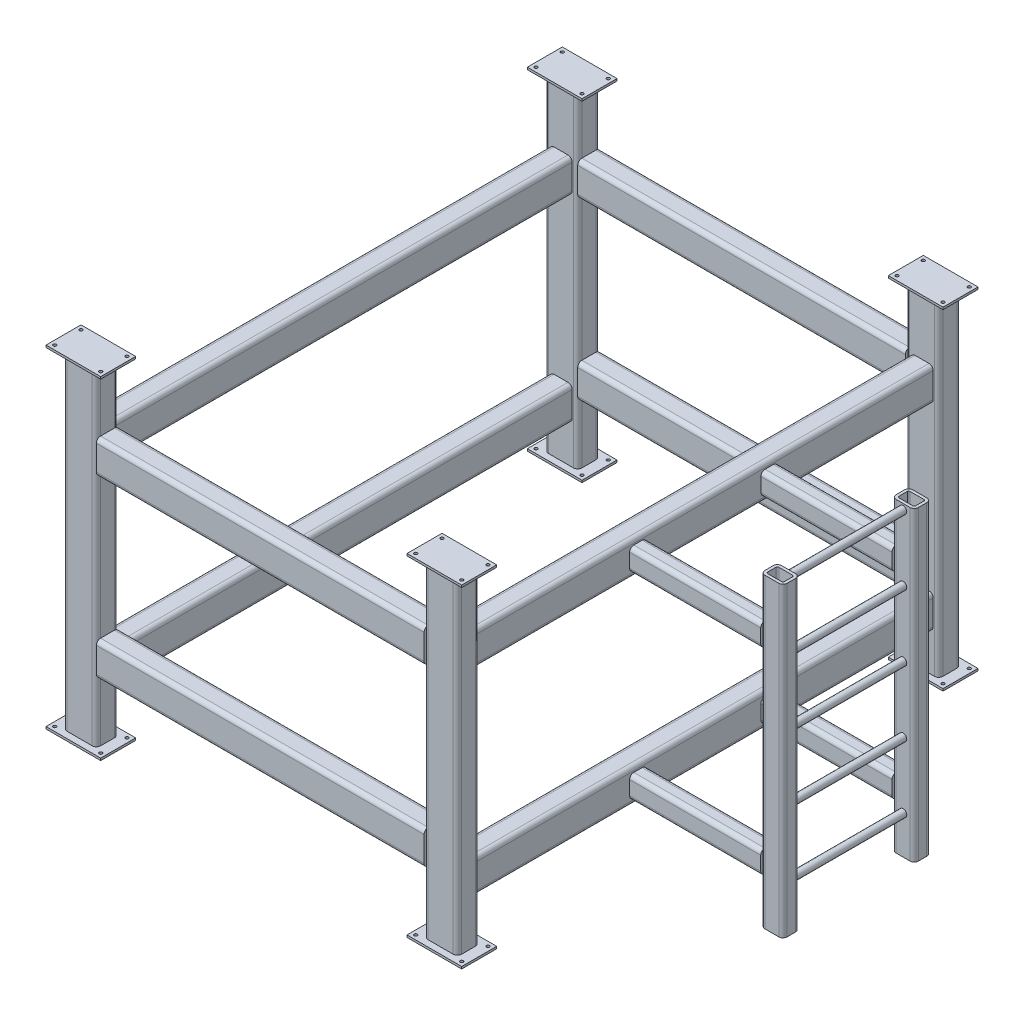
from build123d import *

# Parameters (mm, degrees)
RECTANGULAR_TUBE_6_X_4_X_0_5_1_DEPTH    = 1500
RECTANGULAR_TUBE_6_X_4_X_0_5_1_2_DEPTH  = 1500
RECTANGULAR_TUBE_6_X_4_X_0_5_1_3_DEPTH  = 1500
RECTANGULAR_TUBE_6_X_4_X_0_5_1_4_DEPTH  = 1500
RECTANGULAR_TUBE_6_X_4_X_0_5_2_DEPTH    = 2200
RECTANGULAR_TUBE_6_X_4_X_0_5_2_2_DEPTH  = 2200
RECTANGULAR_TUBE_6_X_4_X_0_5_2_3_DEPTH  = 2200
RECTANGULAR_TUBE_6_X_4_X_0_5_2_4_DEPTH  = 2200
RECTANGULAR_TUBE_6_X_4_X_0_5_5_DEPTH    = 1650
RECTANGULAR_TUBE_6_X_4_X_0_5_5_2_DEPTH  = 1650
RECTANGULAR_TUBE_6_X_4_X_0_5_5_3_DEPTH  = 1650
RECTANGULAR_TUBE_6_X_4_X_0_5_5_4_DEPTH  = 1650
SKETCH14_W                              = 250
SKETCH14_H                              = 160
SKETCH14_R                              = 7
BOSS_EXTRUDE1_DEPTH                     = 10
BOSS_EXTRUDE1_2_DEPTH                   = 10
BOSS_EXTRUDE1_3_DEPTH                   = 10
BOSS_EXTRUDE1_4_DEPTH                   = 10
BOSS_EXTRUDE2_START                     = -1500
SKETCH14_2_W                            = 250
SKETCH14_2_H                            = 160
SKETCH14_2_R                            = 7
BOSS_EXTRUDE2_DEPTH                     = 10
BOSS_EXTRUDE2_2_DEPTH                   = 10
BOSS_EXTRUDE2_3_DEPTH                   = 10
BOSS_EXTRUDE2_4_DEPTH                   = 10
RECTANGULAR_TUBE_4_X_3_X_0_25_1_DEPTH   = 651
RECTANGULAR_TUBE_4_X_3_X_0_25_1_2_DEPTH = 651
RECTANGULAR_TUBE_4_X_3_X_0_25_1_3_DEPTH = 651
RECTANGULAR_TUBE_4_X_3_X_0_25_1_4_DEPTH = 651
RECTANGULAR_TUBE_4_X_3_X_0_25_1_5_DEPTH = 1400
RECTANGULAR_TUBE_4_X_3_X_0_25_1_6_DEPTH = 1400
SKETCH111_R                             = 16.7005
SKETCH111_R_2                           = 13.3223
PIPE_1_0_SCH_40_1_DEPTH                 = 523.8
LPATTERN1_COUNT                         = 5
LPATTERN1_PITCH                         = 300


with BuildPart() as part:
    # Sketch1 → Rectangular tube 6 X 4 X 0.5(1) (new body)
    with BuildSketch(Plane(origin=(-825, 0, 1100), x_dir=(0, 0, -1), z_dir=(0, 1, 0))):
        with BuildLine():
            Line((-31.75, -76.2), (31.75, -76.2))
            ThreePointArc((31.75, -76.2), (45.220384182, -70.620384182), (50.8, -57.15))
            Line((50.8, -57.15), (50.8, 57.15))
            ThreePointArc((50.8, 57.15), (45.220384182, 70.620384182), (31.75, 76.2))
            Line((31.75, 76.2), (-31.75, 76.2))
            ThreePointArc((-31.75, 76.2), (-45.220384182, 70.620384182), (-50.8, 57.15))
            Line((-50.8, 57.15), (-50.8, -57.15))
            ThreePointArc((-50.8, -57.15), (-45.220384182, -70.620384182), (-31.75, -76.2))
        make_face()
        with BuildLine():
            Line((-31.75, -63.5), (31.75, -63.5))
            ThreePointArc((31.75, -63.5), (36.240128061, -61.640128061), (38.1, -57.15))
            Line((38.1, -57.15), (38.1, 57.15))
            ThreePointArc((38.1, 57.15), (36.240128061, 61.640128061), (31.75, 63.5))
            Line((31.75, 63.5), (-31.75, 63.5))
            ThreePointArc((-31.75, 63.5), (-36.240128061, 61.640128061), (-38.1, 57.15))
            Line((-38.1, 57.15), (-38.1, -57.15))
            ThreePointArc((-38.1, -57.15), (-36.240128061, -61.640128061), (-31.75, -63.5))
        make_face(mode=Mode.SUBTRACT)
    extrude(amount=RECTANGULAR_TUBE_6_X_4_X_0_5_1_DEPTH)


with BuildPart() as body_2:
    # Sketch1 on segment 2 (carried to segment 2) → Rectangular tube 6 X 4 X 0.5_1 2 (new body)
    with BuildSketch(Plane(origin=(-825, 0, -1100), x_dir=(0, 0, -1), z_dir=(0, 1, 0))):
        with BuildLine():
            Line((-31.75, -76.2), (31.75, -76.2))
            ThreePointArc((31.75, -76.2), (45.220384182, -70.620384182), (50.8, -57.15))
            Line((50.8, -57.15), (50.8, 57.15))
            ThreePointArc((50.8, 57.15), (45.220384182, 70.620384182), (31.75, 76.2))
            Line((31.75, 76.2), (-31.75, 76.2))
            ThreePointArc((-31.75, 76.2), (-45.220384182, 70.620384182), (-50.8, 57.15))
            Line((-50.8, 57.15), (-50.8, -57.15))
            ThreePointArc((-50.8, -57.15), (-45.220384182, -70.620384182), (-31.75, -76.2))
        make_face()
        with BuildLine():
            Line((-31.75, -63.5), (31.75, -63.5))
            ThreePointArc((31.75, -63.5), (36.240128061, -61.640128061), (38.1, -57.15))
            Line((38.1, -57.15), (38.1, 57.15))
            ThreePointArc((38.1, 57.15), (36.240128061, 61.640128061), (31.75, 63.5))
            Line((31.75, 63.5), (-31.75, 63.5))
            ThreePointArc((-31.75, 63.5), (-36.240128061, 61.640128061), (-38.1, 57.15))
            Line((-38.1, 57.15), (-38.1, -57.15))
            ThreePointArc((-38.1, -57.15), (-36.240128061, -61.640128061), (-31.75, -63.5))
        make_face(mode=Mode.SUBTRACT)
    extrude(amount=RECTANGULAR_TUBE_6_X_4_X_0_5_1_2_DEPTH)


with BuildPart() as body_3:
    # Sketch1 on segment 3 (carried to segment 3) → Rectangular tube 6 X 4 X 0.5_1 3 (new body)
    with BuildSketch(Plane(origin=(825, 0, 1100), x_dir=(0, 0, -1), z_dir=(0, 1, 0))):
        with BuildLine():
            Line((-31.75, -76.2), (31.75, -76.2))
            ThreePointArc((31.75, -76.2), (45.220384182, -70.620384182), (50.8, -57.15))
            Line((50.8, -57.15), (50.8, 57.15))
            ThreePointArc((50.8, 57.15), (45.220384182, 70.620384182), (31.75, 76.2))
            Line((31.75, 76.2), (-31.75, 76.2))
            ThreePointArc((-31.75, 76.2), (-45.220384182, 70.620384182), (-50.8, 57.15))
            Line((-50.8, 57.15), (-50.8, -57.15))
            ThreePointArc((-50.8, -57.15), (-45.220384182, -70.620384182), (-31.75, -76.2))
        make_face()
        with BuildLine():
            Line((-31.75, -63.5), (31.75, -63.5))
            ThreePointArc((31.75, -63.5), (36.240128061, -61.640128061), (38.1, -57.15))
            Line((38.1, -57.15), (38.1, 57.15))
            ThreePointArc((38.1, 57.15), (36.240128061, 61.640128061), (31.75, 63.5))
            Line((31.75, 63.5), (-31.75, 63.5))
            ThreePointArc((-31.75, 63.5), (-36.240128061, 61.640128061), (-38.1, 57.15))
            Line((-38.1, 57.15), (-38.1, -57.15))
            ThreePointArc((-38.1, -57.15), (-36.240128061, -61.640128061), (-31.75, -63.5))
        make_face(mode=Mode.SUBTRACT)
    extrude(amount=RECTANGULAR_TUBE_6_X_4_X_0_5_1_3_DEPTH)


with BuildPart() as body_4:
    # Sketch1 on segment 4 (carried to segment 4) → Rectangular tube 6 X 4 X 0.5_1 4 (new body)
    with BuildSketch(Plane(origin=(825, 0, -1100), x_dir=(0, 0, -1), z_dir=(0, 1, 0))):
        with BuildLine():
            Line((-31.75, -76.2), (31.75, -76.2))
            ThreePointArc((31.75, -76.2), (45.220384182, -70.620384182), (50.8, -57.15))
            Line((50.8, -57.15), (50.8, 57.15))
            ThreePointArc((50.8, 57.15), (45.220384182, 70.620384182), (31.75, 76.2))
            Line((31.75, 76.2), (-31.75, 76.2))
            ThreePointArc((-31.75, 76.2), (-45.220384182, 70.620384182), (-50.8, 57.15))
            Line((-50.8, 57.15), (-50.8, -57.15))
            ThreePointArc((-50.8, -57.15), (-45.220384182, -70.620384182), (-31.75, -76.2))
        make_face()
        with BuildLine():
            Line((-31.75, -63.5), (31.75, -63.5))
            ThreePointArc((31.75, -63.5), (36.240128061, -61.640128061), (38.1, -57.15))
            Line((38.1, -57.15), (38.1, 57.15))
            ThreePointArc((38.1, 57.15), (36.240128061, 61.640128061), (31.75, 63.5))
            Line((31.75, 63.5), (-31.75, 63.5))
            ThreePointArc((-31.75, 63.5), (-36.240128061, 61.640128061), (-38.1, 57.15))
            Line((-38.1, 57.15), (-38.1, -57.15))
            ThreePointArc((-38.1, -57.15), (-36.240128061, -61.640128061), (-31.75, -63.5))
        make_face(mode=Mode.SUBTRACT)
    extrude(amount=RECTANGULAR_TUBE_6_X_4_X_0_5_1_4_DEPTH)


with BuildPart() as body_5:
    # Sketch11 → Rectangular tube 6 X 4 X 0.5(2) (new body)
    with BuildSketch(Plane(origin=(-825, 1150, 1100), x_dir=(1, 0, 0), z_dir=(0, 0, -1))):
        with BuildLine():
            Line((-31.75, -76.2), (31.75, -76.2))
            ThreePointArc((31.75, -76.2), (45.220384182, -70.620384182), (50.8, -57.15))
            Line((50.8, -57.15), (50.8, 57.15))
            ThreePointArc((50.8, 57.15), (45.220384182, 70.620384182), (31.75, 76.2))
            Line((31.75, 76.2), (-31.75, 76.2))
            ThreePointArc((-31.75, 76.2), (-45.220384182, 70.620384182), (-50.8, 57.15))
            Line((-50.8, 57.15), (-50.8, -57.15))
            ThreePointArc((-50.8, -57.15), (-45.220384182, -70.620384182), (-31.75, -76.2))
        make_face()
        with BuildLine():
            Line((-31.75, -63.5), (31.75, -63.5))
            ThreePointArc((31.75, -63.5), (36.240128061, -61.640128061), (38.1, -57.15))
            Line((38.1, -57.15), (38.1, 57.15))
            ThreePointArc((38.1, 57.15), (36.240128061, 61.640128061), (31.75, 63.5))
            Line((31.75, 63.5), (-31.75, 63.5))
            ThreePointArc((-31.75, 63.5), (-36.240128061, 61.640128061), (-38.1, 57.15))
            Line((-38.1, 57.15), (-38.1, -57.15))
            ThreePointArc((-38.1, -57.15), (-36.240128061, -61.640128061), (-31.75, -63.5))
        make_face(mode=Mode.SUBTRACT)
    extrude(amount=RECTANGULAR_TUBE_6_X_4_X_0_5_2_DEPTH)

    # Trim_Extend1 3
    split(bisect_by=Plane(origin=(-825, 750, 1049.2), x_dir=(0, 1, 0), z_dir=(0, 0, -1)), keep=Keep.TOP)

    # Trim_Extend1 5
    split(bisect_by=Plane(origin=(-825, 750, -1049.2), x_dir=(0, -1, 0), z_dir=(0, 0, 1)), keep=Keep.TOP)


with BuildPart() as body_6:
    # Sketch11 on segment 2 (carried to segment 2) → Rectangular tube 6 X 4 X 0.5_2 2 (new body)
    with BuildSketch(Plane(origin=(-825, 250, 1100), x_dir=(1, 0, 0), z_dir=(0, 0, -1))):
        with BuildLine():
            Line((-31.75, -76.2), (31.75, -76.2))
            ThreePointArc((31.75, -76.2), (45.220384182, -70.620384182), (50.8, -57.15))
            Line((50.8, -57.15), (50.8, 57.15))
            ThreePointArc((50.8, 57.15), (45.220384182, 70.620384182), (31.75, 76.2))
            Line((31.75, 76.2), (-31.75, 76.2))
            ThreePointArc((-31.75, 76.2), (-45.220384182, 70.620384182), (-50.8, 57.15))
            Line((-50.8, 57.15), (-50.8, -57.15))
            ThreePointArc((-50.8, -57.15), (-45.220384182, -70.620384182), (-31.75, -76.2))
        make_face()
        with BuildLine():
            Line((-31.75, -63.5), (31.75, -63.5))
            ThreePointArc((31.75, -63.5), (36.240128061, -61.640128061), (38.1, -57.15))
            Line((38.1, -57.15), (38.1, 57.15))
            ThreePointArc((38.1, 57.15), (36.240128061, 61.640128061), (31.75, 63.5))
            Line((31.75, 63.5), (-31.75, 63.5))
            ThreePointArc((-31.75, 63.5), (-36.240128061, 61.640128061), (-38.1, 57.15))
            Line((-38.1, 57.15), (-38.1, -57.15))
            ThreePointArc((-38.1, -57.15), (-36.240128061, -61.640128061), (-31.75, -63.5))
        make_face(mode=Mode.SUBTRACT)
    extrude(amount=RECTANGULAR_TUBE_6_X_4_X_0_5_2_2_DEPTH)

    # Trim_Extend1 3
    split(bisect_by=Plane(origin=(-825, 750, 1049.2), x_dir=(0, 1, 0), z_dir=(0, 0, -1)), keep=Keep.TOP)

    # Trim_Extend1 5
    split(bisect_by=Plane(origin=(-825, 750, -1049.2), x_dir=(0, -1, 0), z_dir=(0, 0, 1)), keep=Keep.TOP)


with BuildPart() as body_7:
    # Sketch11 on segment 3 (carried to segment 3) → Rectangular tube 6 X 4 X 0.5_2 3 (new body)
    with BuildSketch(Plane(origin=(825, 1150, 1100), x_dir=(1, 0, 0), z_dir=(0, 0, -1))):
        with BuildLine():
            Line((-31.75, -76.2), (31.75, -76.2))
            ThreePointArc((31.75, -76.2), (45.220384182, -70.620384182), (50.8, -57.15))
            Line((50.8, -57.15), (50.8, 57.15))
            ThreePointArc((50.8, 57.15), (45.220384182, 70.620384182), (31.75, 76.2))
            Line((31.75, 76.2), (-31.75, 76.2))
            ThreePointArc((-31.75, 76.2), (-45.220384182, 70.620384182), (-50.8, 57.15))
            Line((-50.8, 57.15), (-50.8, -57.15))
            ThreePointArc((-50.8, -57.15), (-45.220384182, -70.620384182), (-31.75, -76.2))
        make_face()
        with BuildLine():
            Line((-31.75, -63.5), (31.75, -63.5))
            ThreePointArc((31.75, -63.5), (36.240128061, -61.640128061), (38.1, -57.15))
            Line((38.1, -57.15), (38.1, 57.15))
            ThreePointArc((38.1, 57.15), (36.240128061, 61.640128061), (31.75, 63.5))
            Line((31.75, 63.5), (-31.75, 63.5))
            ThreePointArc((-31.75, 63.5), (-36.240128061, 61.640128061), (-38.1, 57.15))
            Line((-38.1, 57.15), (-38.1, -57.15))
            ThreePointArc((-38.1, -57.15), (-36.240128061, -61.640128061), (-31.75, -63.5))
        make_face(mode=Mode.SUBTRACT)
    extrude(amount=RECTANGULAR_TUBE_6_X_4_X_0_5_2_3_DEPTH)

    # Trim_Extend1 3
    split(bisect_by=Plane(origin=(-825, 750, 1049.2), x_dir=(0, 1, 0), z_dir=(0, 0, -1)), keep=Keep.TOP)

    # Trim_Extend1 5
    split(bisect_by=Plane(origin=(-825, 750, -1049.2), x_dir=(0, -1, 0), z_dir=(0, 0, 1)), keep=Keep.TOP)


with BuildPart() as body_8:
    # Sketch11 on segment 4 (carried to segment 4) → Rectangular tube 6 X 4 X 0.5_2 4 (new body)
    with BuildSketch(Plane(origin=(825, 250, 1100), x_dir=(1, 0, 0), z_dir=(0, 0, -1))):
        with BuildLine():
            Line((-31.75, -76.2), (31.75, -76.2))
            ThreePointArc((31.75, -76.2), (45.220384182, -70.620384182), (50.8, -57.15))
            Line((50.8, -57.15), (50.8, 57.15))
            ThreePointArc((50.8, 57.15), (45.220384182, 70.620384182), (31.75, 76.2))
            Line((31.75, 76.2), (-31.75, 76.2))
            ThreePointArc((-31.75, 76.2), (-45.220384182, 70.620384182), (-50.8, 57.15))
            Line((-50.8, 57.15), (-50.8, -57.15))
            ThreePointArc((-50.8, -57.15), (-45.220384182, -70.620384182), (-31.75, -76.2))
        make_face()
        with BuildLine():
            Line((-31.75, -63.5), (31.75, -63.5))
            ThreePointArc((31.75, -63.5), (36.240128061, -61.640128061), (38.1, -57.15))
            Line((38.1, -57.15), (38.1, 57.15))
            ThreePointArc((38.1, 57.15), (36.240128061, 61.640128061), (31.75, 63.5))
            Line((31.75, 63.5), (-31.75, 63.5))
            ThreePointArc((-31.75, 63.5), (-36.240128061, 61.640128061), (-38.1, 57.15))
            Line((-38.1, 57.15), (-38.1, -57.15))
            ThreePointArc((-38.1, -57.15), (-36.240128061, -61.640128061), (-31.75, -63.5))
        make_face(mode=Mode.SUBTRACT)
    extrude(amount=RECTANGULAR_TUBE_6_X_4_X_0_5_2_4_DEPTH)

    # Trim_Extend1 3
    split(bisect_by=Plane(origin=(-825, 750, 1049.2), x_dir=(0, 1, 0), z_dir=(0, 0, -1)), keep=Keep.TOP)

    # Trim_Extend1 5
    split(bisect_by=Plane(origin=(-825, 750, -1049.2), x_dir=(0, -1, 0), z_dir=(0, 0, 1)), keep=Keep.TOP)


with BuildPart() as body_9:
    # Sketch13 → Rectangular tube 6 X 4 X 0.5(5) (new body)
    with BuildSketch(Plane(origin=(-825, 1150, 1100), x_dir=(0, 0, -1), z_dir=(1, 0, 0))):
        with BuildLine():
            Line((-31.75, -76.2), (31.75, -76.2))
            ThreePointArc((31.75, -76.2), (45.220384182, -70.620384182), (50.8, -57.15))
            Line((50.8, -57.15), (50.8, 57.15))
            ThreePointArc((50.8, 57.15), (45.220384182, 70.620384182), (31.75, 76.2))
            Line((31.75, 76.2), (-31.75, 76.2))
            ThreePointArc((-31.75, 76.2), (-45.220384182, 70.620384182), (-50.8, 57.15))
            Line((-50.8, 57.15), (-50.8, -57.15))
            ThreePointArc((-50.8, -57.15), (-45.220384182, -70.620384182), (-31.75, -76.2))
        make_face()
        with BuildLine():
            Line((-31.75, -63.5), (31.75, -63.5))
            ThreePointArc((31.75, -63.5), (36.240128061, -61.640128061), (38.1, -57.15))
            Line((38.1, -57.15), (38.1, 57.15))
            ThreePointArc((38.1, 57.15), (36.240128061, 61.640128061), (31.75, 63.5))
            Line((31.75, 63.5), (-31.75, 63.5))
            ThreePointArc((-31.75, 63.5), (-36.240128061, 61.640128061), (-38.1, 57.15))
            Line((-38.1, 57.15), (-38.1, -57.15))
            ThreePointArc((-38.1, -57.15), (-36.240128061, -61.640128061), (-31.75, -63.5))
        make_face(mode=Mode.SUBTRACT)
    extrude(amount=RECTANGULAR_TUBE_6_X_4_X_0_5_5_DEPTH)

    # Trim/Extend1
    split(bisect_by=Plane(origin=(-748.8, 750, 1100), x_dir=(0, 1, 0), z_dir=(1, 0, 0)), keep=Keep.TOP)

    # Trim_Extend1 9
    split(bisect_by=Plane(origin=(748.8, 750, -1100), x_dir=(0, -1, 0), z_dir=(-1, 0, 0)), keep=Keep.TOP)


with BuildPart() as body_10:
    # Sketch13 on segment 2 (carried to segment 2) → Rectangular tube 6 X 4 X 0.5_5 2 (new body)
    with BuildSketch(Plane(origin=(-825, 350, 1100), x_dir=(0, 0, -1), z_dir=(1, 0, 0))):
        with BuildLine():
            Line((-31.75, -76.2), (31.75, -76.2))
            ThreePointArc((31.75, -76.2), (45.220384182, -70.620384182), (50.8, -57.15))
            Line((50.8, -57.15), (50.8, 57.15))
            ThreePointArc((50.8, 57.15), (45.220384182, 70.620384182), (31.75, 76.2))
            Line((31.75, 76.2), (-31.75, 76.2))
            ThreePointArc((-31.75, 76.2), (-45.220384182, 70.620384182), (-50.8, 57.15))
            Line((-50.8, 57.15), (-50.8, -57.15))
            ThreePointArc((-50.8, -57.15), (-45.220384182, -70.620384182), (-31.75, -76.2))
        make_face()
        with BuildLine():
            Line((-31.75, -63.5), (31.75, -63.5))
            ThreePointArc((31.75, -63.5), (36.240128061, -61.640128061), (38.1, -57.15))
            Line((38.1, -57.15), (38.1, 57.15))
            ThreePointArc((38.1, 57.15), (36.240128061, 61.640128061), (31.75, 63.5))
            Line((31.75, 63.5), (-31.75, 63.5))
            ThreePointArc((-31.75, 63.5), (-36.240128061, 61.640128061), (-38.1, 57.15))
            Line((-38.1, 57.15), (-38.1, -57.15))
            ThreePointArc((-38.1, -57.15), (-36.240128061, -61.640128061), (-31.75, -63.5))
        make_face(mode=Mode.SUBTRACT)
    extrude(amount=RECTANGULAR_TUBE_6_X_4_X_0_5_5_2_DEPTH)

    # Trim/Extend1
    split(bisect_by=Plane(origin=(-748.8, 750, 1100), x_dir=(0, 1, 0), z_dir=(1, 0, 0)), keep=Keep.TOP)

    # Trim_Extend1 9
    split(bisect_by=Plane(origin=(748.8, 750, -1100), x_dir=(0, -1, 0), z_dir=(-1, 0, 0)), keep=Keep.TOP)


with BuildPart() as body_11:
    # Sketch13 on segment 3 (carried to segment 3) → Rectangular tube 6 X 4 X 0.5_5 3 (new body)
    with BuildSketch(Plane(origin=(-825, 1150, -1100), x_dir=(0, 0, -1), z_dir=(1, 0, 0))):
        with BuildLine():
            Line((-31.75, -76.2), (31.75, -76.2))
            ThreePointArc((31.75, -76.2), (45.220384182, -70.620384182), (50.8, -57.15))
            Line((50.8, -57.15), (50.8, 57.15))
            ThreePointArc((50.8, 57.15), (45.220384182, 70.620384182), (31.75, 76.2))
            Line((31.75, 76.2), (-31.75, 76.2))
            ThreePointArc((-31.75, 76.2), (-45.220384182, 70.620384182), (-50.8, 57.15))
            Line((-50.8, 57.15), (-50.8, -57.15))
            ThreePointArc((-50.8, -57.15), (-45.220384182, -70.620384182), (-31.75, -76.2))
        make_face()
        with BuildLine():
            Line((-31.75, -63.5), (31.75, -63.5))
            ThreePointArc((31.75, -63.5), (36.240128061, -61.640128061), (38.1, -57.15))
            Line((38.1, -57.15), (38.1, 57.15))
            ThreePointArc((38.1, 57.15), (36.240128061, 61.640128061), (31.75, 63.5))
            Line((31.75, 63.5), (-31.75, 63.5))
            ThreePointArc((-31.75, 63.5), (-36.240128061, 61.640128061), (-38.1, 57.15))
            Line((-38.1, 57.15), (-38.1, -57.15))
            ThreePointArc((-38.1, -57.15), (-36.240128061, -61.640128061), (-31.75, -63.5))
        make_face(mode=Mode.SUBTRACT)
    extrude(amount=RECTANGULAR_TUBE_6_X_4_X_0_5_5_3_DEPTH)

    # Trim/Extend1
    split(bisect_by=Plane(origin=(-748.8, 750, 1100), x_dir=(0, 1, 0), z_dir=(1, 0, 0)), keep=Keep.TOP)

    # Trim_Extend1 9
    split(bisect_by=Plane(origin=(748.8, 750, -1100), x_dir=(0, -1, 0), z_dir=(-1, 0, 0)), keep=Keep.TOP)


with BuildPart() as body_12:
    # Sketch13 on segment 4 (carried to segment 4) → Rectangular tube 6 X 4 X 0.5_5 4 (new body)
    with BuildSketch(Plane(origin=(-825, 350, -1100), x_dir=(0, 0, -1), z_dir=(1, 0, 0))):
        with BuildLine():
            Line((-31.75, -76.2), (31.75, -76.2))
            ThreePointArc((31.75, -76.2), (45.220384182, -70.620384182), (50.8, -57.15))
            Line((50.8, -57.15), (50.8, 57.15))
            ThreePointArc((50.8, 57.15), (45.220384182, 70.620384182), (31.75, 76.2))
            Line((31.75, 76.2), (-31.75, 76.2))
            ThreePointArc((-31.75, 76.2), (-45.220384182, 70.620384182), (-50.8, 57.15))
            Line((-50.8, 57.15), (-50.8, -57.15))
            ThreePointArc((-50.8, -57.15), (-45.220384182, -70.620384182), (-31.75, -76.2))
        make_face()
        with BuildLine():
            Line((-31.75, -63.5), (31.75, -63.5))
            ThreePointArc((31.75, -63.5), (36.240128061, -61.640128061), (38.1, -57.15))
            Line((38.1, -57.15), (38.1, 57.15))
            ThreePointArc((38.1, 57.15), (36.240128061, 61.640128061), (31.75, 63.5))
            Line((31.75, 63.5), (-31.75, 63.5))
            ThreePointArc((-31.75, 63.5), (-36.240128061, 61.640128061), (-38.1, 57.15))
            Line((-38.1, 57.15), (-38.1, -57.15))
            ThreePointArc((-38.1, -57.15), (-36.240128061, -61.640128061), (-31.75, -63.5))
        make_face(mode=Mode.SUBTRACT)
    extrude(amount=RECTANGULAR_TUBE_6_X_4_X_0_5_5_4_DEPTH)

    # Trim/Extend1
    split(bisect_by=Plane(origin=(-748.8, 750, 1100), x_dir=(0, 1, 0), z_dir=(1, 0, 0)), keep=Keep.TOP)

    # Trim_Extend1 9
    split(bisect_by=Plane(origin=(748.8, 750, -1100), x_dir=(0, -1, 0), z_dir=(-1, 0, 0)), keep=Keep.TOP)


with BuildPart() as body_13:
    # Sketch14 → Boss-Extrude1 (new body)
    with BuildSketch(Plane(origin=(0, 1500, 0), x_dir=(1, 0, 0), z_dir=(0, 1, 0))):
        with Locations((-825, -1100)):
            Rectangle(SKETCH14_W, SKETCH14_H)
        with Locations(Location((-930, -1040, 0), (0, 0, 270))):
            Circle(SKETCH14_R, mode=Mode.SUBTRACT)
        with Locations(Location((-720, -1040, 0), (0, 0, 270))):
            Circle(SKETCH14_R, mode=Mode.SUBTRACT)
        with Locations(Location((-720, -1160, 0), (0, 0, 270))):
            Circle(SKETCH14_R, mode=Mode.SUBTRACT)
        with Locations(Location((-930, -1160, 0), (0, 0, 270))):
            Circle(SKETCH14_R, mode=Mode.SUBTRACT)
    extrude(amount=BOSS_EXTRUDE1_DEPTH)


with BuildPart() as body_14:
    # Sketch14 → Boss-Extrude1 2 (new body)
    with BuildSketch(Plane(origin=(0, 1500, 0), x_dir=(1, 0, 0), z_dir=(0, 1, 0))):
        with Locations((825, -1100)):
            Rectangle(SKETCH14_W, SKETCH14_H)
        with Locations(Location((930, -1160, 0), (0, 0, 90))):
            Circle(SKETCH14_R, mode=Mode.SUBTRACT)
        with Locations(Location((720, -1160, 0), (0, 0, 90))):
            Circle(SKETCH14_R, mode=Mode.SUBTRACT)
        with Locations(Location((720, -1040, 0), (0, 0, 90))):
            Circle(SKETCH14_R, mode=Mode.SUBTRACT)
        with Locations(Location((930, -1040, 0), (0, 0, 90))):
            Circle(SKETCH14_R, mode=Mode.SUBTRACT)
    extrude(amount=BOSS_EXTRUDE1_2_DEPTH)


with BuildPart() as body_15:
    # Sketch14 → Boss-Extrude1 3 (new body)
    with BuildSketch(Plane(origin=(0, 1500, 0), x_dir=(1, 0, 0), z_dir=(0, 1, 0))):
        with Locations((825, 1100)):
            Rectangle(SKETCH14_W, SKETCH14_H)
        with Locations(Location((930, 1040, 0), (0, 0, 270))):
            Circle(SKETCH14_R, mode=Mode.SUBTRACT)
        with Locations(Location((720, 1040, 0), (0, 0, 270))):
            Circle(SKETCH14_R, mode=Mode.SUBTRACT)
        with Locations(Location((720, 1160, 0), (0, 0, 270))):
            Circle(SKETCH14_R, mode=Mode.SUBTRACT)
        with Locations(Location((930, 1160, 0), (0, 0, 270))):
            Circle(SKETCH14_R, mode=Mode.SUBTRACT)
    extrude(amount=BOSS_EXTRUDE1_3_DEPTH)


with BuildPart() as body_16:
    # Sketch14 → Boss-Extrude1 4 (new body)
    with BuildSketch(Plane(origin=(0, 1500, 0), x_dir=(1, 0, 0), z_dir=(0, 1, 0))):
        with Locations((-825, 1100)):
            Rectangle(SKETCH14_W, SKETCH14_H)
        with Locations(Location((-930, 1160, 0), (0, 0, 90))):
            Circle(SKETCH14_R, mode=Mode.SUBTRACT)
        with Locations(Location((-720, 1160, 0), (0, 0, 90))):
            Circle(SKETCH14_R, mode=Mode.SUBTRACT)
        with Locations(Location((-720, 1040, 0), (0, 0, 90))):
            Circle(SKETCH14_R, mode=Mode.SUBTRACT)
        with Locations(Location((-930, 1040, 0), (0, 0, 90))):
            Circle(SKETCH14_R, mode=Mode.SUBTRACT)
    extrude(amount=BOSS_EXTRUDE1_4_DEPTH)


with BuildPart() as body_17:
    # Sketch14<2> → Boss-Extrude2 (new body)
    with BuildSketch(Plane(origin=(0, 1500, 0), x_dir=(1, 0, 0), z_dir=(0, 1, 0)).offset(BOSS_EXTRUDE2_START)):
        with Locations((-825, -1100)):
            Rectangle(SKETCH14_2_W, SKETCH14_2_H)
        with Locations(Location((-930, -1040, 0), (0, 0, 270))):
            Circle(SKETCH14_2_R, mode=Mode.SUBTRACT)
        with Locations(Location((-720, -1040, 0), (0, 0, 270))):
            Circle(SKETCH14_2_R, mode=Mode.SUBTRACT)
        with Locations(Location((-720, -1160, 0), (0, 0, 270))):
            Circle(SKETCH14_2_R, mode=Mode.SUBTRACT)
        with Locations(Location((-930, -1160, 0), (0, 0, 270))):
            Circle(SKETCH14_2_R, mode=Mode.SUBTRACT)
    extrude(amount=-BOSS_EXTRUDE2_DEPTH)


with BuildPart() as body_18:
    # Sketch14<2> → Boss-Extrude2 2 (new body)
    with BuildSketch(Plane(origin=(0, 1500, 0), x_dir=(1, 0, 0), z_dir=(0, 1, 0)).offset(BOSS_EXTRUDE2_START)):
        with Locations((825, -1100)):
            Rectangle(SKETCH14_2_W, SKETCH14_2_H)
        with Locations(Location((930, -1160, 0), (0, 0, 270))):
            Circle(SKETCH14_2_R, mode=Mode.SUBTRACT)
        with Locations(Location((720, -1160, 0), (0, 0, 270))):
            Circle(SKETCH14_2_R, mode=Mode.SUBTRACT)
        with Locations(Location((720, -1040, 0), (0, 0, 270))):
            Circle(SKETCH14_2_R, mode=Mode.SUBTRACT)
        with Locations(Location((930, -1040, 0), (0, 0, 270))):
            Circle(SKETCH14_2_R, mode=Mode.SUBTRACT)
    extrude(amount=-BOSS_EXTRUDE2_2_DEPTH)


with BuildPart() as body_19:
    # Sketch14<2> → Boss-Extrude2 3 (new body)
    with BuildSketch(Plane(origin=(0, 1500, 0), x_dir=(1, 0, 0), z_dir=(0, 1, 0)).offset(BOSS_EXTRUDE2_START)):
        with Locations((825, 1100)):
            Rectangle(SKETCH14_2_W, SKETCH14_2_H)
        with Locations(Location((930, 1040, 0), (0, 0, 270))):
            Circle(SKETCH14_2_R, mode=Mode.SUBTRACT)
        with Locations(Location((720, 1040, 0), (0, 0, 270))):
            Circle(SKETCH14_2_R, mode=Mode.SUBTRACT)
        with Locations(Location((720, 1160, 0), (0, 0, 270))):
            Circle(SKETCH14_2_R, mode=Mode.SUBTRACT)
        with Locations(Location((930, 1160, 0), (0, 0, 270))):
            Circle(SKETCH14_2_R, mode=Mode.SUBTRACT)
    extrude(amount=-BOSS_EXTRUDE2_3_DEPTH)


with BuildPart() as body_20:
    # Sketch14<2> → Boss-Extrude2 4 (new body)
    with BuildSketch(Plane(origin=(0, 1500, 0), x_dir=(1, 0, 0), z_dir=(0, 1, 0)).offset(BOSS_EXTRUDE2_START)):
        with Locations((-825, 1100)):
            Rectangle(SKETCH14_2_W, SKETCH14_2_H)
        with Locations(Location((-930, 1160, 0), (0, 0, 270))):
            Circle(SKETCH14_2_R, mode=Mode.SUBTRACT)
        with Locations(Location((-720, 1160, 0), (0, 0, 270))):
            Circle(SKETCH14_2_R, mode=Mode.SUBTRACT)
        with Locations(Location((-720, 1040, 0), (0, 0, 270))):
            Circle(SKETCH14_2_R, mode=Mode.SUBTRACT)
        with Locations(Location((-930, 1040, 0), (0, 0, 270))):
            Circle(SKETCH14_2_R, mode=Mode.SUBTRACT)
    extrude(amount=-BOSS_EXTRUDE2_4_DEPTH)


with BuildPart() as body_21:
    # Sketch110 → Rectangular tube 4 X 3 X 0.25(1) (new body)
    with BuildSketch(Plane(origin=(875.8, 1150, 300), x_dir=(0, 0, -1), z_dir=(1, 0, 0))):
        with BuildLine():
            Line((-19.05, -50.8), (19.05, -50.8))
            ThreePointArc((19.05, -50.8), (32.520384182, -45.220384182), (38.1, -31.75))
            Line((38.1, -31.75), (38.1, 31.75))
            ThreePointArc((38.1, 31.75), (32.520384182, 45.220384182), (19.05, 50.8))
            Line((19.05, 50.8), (-19.05, 50.8))
            ThreePointArc((-19.05, 50.8), (-32.520384182, 45.220384182), (-38.1, 31.75))
            Line((-38.1, 31.75), (-38.1, -31.75))
            ThreePointArc((-38.1, -31.75), (-32.520384182, -45.220384182), (-19.05, -50.8))
        make_face()
        with BuildLine():
            Line((-19.05, -38.1), (19.05, -38.1))
            ThreePointArc((19.05, -38.1), (23.540128061, -36.240128061), (25.4, -31.75))
            Line((25.4, -31.75), (25.4, 31.75))
            ThreePointArc((25.4, 31.75), (23.540128061, 36.240128061), (19.05, 38.1))
            Line((19.05, 38.1), (-19.05, 38.1))
            ThreePointArc((-19.05, 38.1), (-23.540128061, 36.240128061), (-25.4, 31.75))
            Line((-25.4, 31.75), (-25.4, -31.75))
            ThreePointArc((-25.4, -31.75), (-23.540128061, -36.240128061), (-19.05, -38.1))
        make_face(mode=Mode.SUBTRACT)
    extrude(amount=RECTANGULAR_TUBE_4_X_3_X_0_25_1_DEPTH)

    # Rectangular tube 4 X 3 X 0.25(1) end butt
    split(bisect_by=Plane(origin=(1475, 1150, 300), x_dir=(0, -1, 0), z_dir=(-1, 0, 0)), keep=Keep.TOP)


with BuildPart() as body_22:
    # Sketch110 on segment 2 (carried to segment 2) → Rectangular tube 4 X 3 X 0.25_1 2 (new body)
    with BuildSketch(Plane(origin=(875.8, 1150, -300), x_dir=(0, 0, -1), z_dir=(1, 0, 0))):
        with BuildLine():
            Line((-19.05, -50.8), (19.05, -50.8))
            ThreePointArc((19.05, -50.8), (32.520384182, -45.220384182), (38.1, -31.75))
            Line((38.1, -31.75), (38.1, 31.75))
            ThreePointArc((38.1, 31.75), (32.520384182, 45.220384182), (19.05, 50.8))
            Line((19.05, 50.8), (-19.05, 50.8))
            ThreePointArc((-19.05, 50.8), (-32.520384182, 45.220384182), (-38.1, 31.75))
            Line((-38.1, 31.75), (-38.1, -31.75))
            ThreePointArc((-38.1, -31.75), (-32.520384182, -45.220384182), (-19.05, -50.8))
        make_face()
        with BuildLine():
            Line((-19.05, -38.1), (19.05, -38.1))
            ThreePointArc((19.05, -38.1), (23.540128061, -36.240128061), (25.4, -31.75))
            Line((25.4, -31.75), (25.4, 31.75))
            ThreePointArc((25.4, 31.75), (23.540128061, 36.240128061), (19.05, 38.1))
            Line((19.05, 38.1), (-19.05, 38.1))
            ThreePointArc((-19.05, 38.1), (-23.540128061, 36.240128061), (-25.4, 31.75))
            Line((-25.4, 31.75), (-25.4, -31.75))
            ThreePointArc((-25.4, -31.75), (-23.540128061, -36.240128061), (-19.05, -38.1))
        make_face(mode=Mode.SUBTRACT)
    extrude(amount=RECTANGULAR_TUBE_4_X_3_X_0_25_1_2_DEPTH)

    # Rectangular tube 4 X 3 X 0.25_1 2 end bu
    split(bisect_by=Plane(origin=(1475, 1150, -300), x_dir=(0, -1, 0), z_dir=(-1, 0, 0)), keep=Keep.TOP)


with BuildPart() as body_23:
    # Sketch110 on segment 3 (carried to segment 3) → Rectangular tube 4 X 3 X 0.25_1 3 (new body)
    with BuildSketch(Plane(origin=(875.8, 250, 300), x_dir=(0, 0, -1), z_dir=(1, 0, 0))):
        with BuildLine():
            Line((-19.05, -50.8), (19.05, -50.8))
            ThreePointArc((19.05, -50.8), (32.520384182, -45.220384182), (38.1, -31.75))
            Line((38.1, -31.75), (38.1, 31.75))
            ThreePointArc((38.1, 31.75), (32.520384182, 45.220384182), (19.05, 50.8))
            Line((19.05, 50.8), (-19.05, 50.8))
            ThreePointArc((-19.05, 50.8), (-32.520384182, 45.220384182), (-38.1, 31.75))
            Line((-38.1, 31.75), (-38.1, -31.75))
            ThreePointArc((-38.1, -31.75), (-32.520384182, -45.220384182), (-19.05, -50.8))
        make_face()
        with BuildLine():
            Line((-19.05, -38.1), (19.05, -38.1))
            ThreePointArc((19.05, -38.1), (23.540128061, -36.240128061), (25.4, -31.75))
            Line((25.4, -31.75), (25.4, 31.75))
            ThreePointArc((25.4, 31.75), (23.540128061, 36.240128061), (19.05, 38.1))
            Line((19.05, 38.1), (-19.05, 38.1))
            ThreePointArc((-19.05, 38.1), (-23.540128061, 36.240128061), (-25.4, 31.75))
            Line((-25.4, 31.75), (-25.4, -31.75))
            ThreePointArc((-25.4, -31.75), (-23.540128061, -36.240128061), (-19.05, -38.1))
        make_face(mode=Mode.SUBTRACT)
    extrude(amount=RECTANGULAR_TUBE_4_X_3_X_0_25_1_3_DEPTH)

    # Rectangular tube 4 X 3 X 0.25_1 3 end bu
    split(bisect_by=Plane(origin=(1475, 250, 300), x_dir=(0, -1, 0), z_dir=(-1, 0, 0)), keep=Keep.TOP)


with BuildPart() as body_24:
    # Sketch110 on segment 4 (carried to segment 4) → Rectangular tube 4 X 3 X 0.25_1 4 (new body)
    with BuildSketch(Plane(origin=(875.8, 250, -300), x_dir=(0, 0, -1), z_dir=(1, 0, 0))):
        with BuildLine():
            Line((-19.05, -50.8), (19.05, -50.8))
            ThreePointArc((19.05, -50.8), (32.520384182, -45.220384182), (38.1, -31.75))
            Line((38.1, -31.75), (38.1, 31.75))
            ThreePointArc((38.1, 31.75), (32.520384182, 45.220384182), (19.05, 50.8))
            Line((19.05, 50.8), (-19.05, 50.8))
            ThreePointArc((-19.05, 50.8), (-32.520384182, 45.220384182), (-38.1, 31.75))
            Line((-38.1, 31.75), (-38.1, -31.75))
            ThreePointArc((-38.1, -31.75), (-32.520384182, -45.220384182), (-19.05, -50.8))
        make_face()
        with BuildLine():
            Line((-19.05, -38.1), (19.05, -38.1))
            ThreePointArc((19.05, -38.1), (23.540128061, -36.240128061), (25.4, -31.75))
            Line((25.4, -31.75), (25.4, 31.75))
            ThreePointArc((25.4, 31.75), (23.540128061, 36.240128061), (19.05, 38.1))
            Line((19.05, 38.1), (-19.05, 38.1))
            ThreePointArc((-19.05, 38.1), (-23.540128061, 36.240128061), (-25.4, 31.75))
            Line((-25.4, 31.75), (-25.4, -31.75))
            ThreePointArc((-25.4, -31.75), (-23.540128061, -36.240128061), (-19.05, -38.1))
        make_face(mode=Mode.SUBTRACT)
    extrude(amount=RECTANGULAR_TUBE_4_X_3_X_0_25_1_4_DEPTH)

    # Rectangular tube 4 X 3 X 0.25_1 4 end bu
    split(bisect_by=Plane(origin=(1475, 250, -300), x_dir=(0, -1, 0), z_dir=(-1, 0, 0)), keep=Keep.TOP)


with BuildPart() as body_25:
    # Sketch110 on segment 5 (carried to segment 5) → Rectangular tube 4 X 3 X 0.25_1 5 (new body)
    with BuildSketch(Plane(origin=(1525.8, 1400, 300), x_dir=(0, 0, -1), z_dir=(0, -1, 0))):
        with BuildLine():
            Line((-19.05, -50.8), (19.05, -50.8))
            ThreePointArc((19.05, -50.8), (32.520384182, -45.220384182), (38.1, -31.75))
            Line((38.1, -31.75), (38.1, 31.75))
            ThreePointArc((38.1, 31.75), (32.520384182, 45.220384182), (19.05, 50.8))
            Line((19.05, 50.8), (-19.05, 50.8))
            ThreePointArc((-19.05, 50.8), (-32.520384182, 45.220384182), (-38.1, 31.75))
            Line((-38.1, 31.75), (-38.1, -31.75))
            ThreePointArc((-38.1, -31.75), (-32.520384182, -45.220384182), (-19.05, -50.8))
        make_face()
        with BuildLine():
            Line((-19.05, -38.1), (19.05, -38.1))
            ThreePointArc((19.05, -38.1), (23.540128061, -36.240128061), (25.4, -31.75))
            Line((25.4, -31.75), (25.4, 31.75))
            ThreePointArc((25.4, 31.75), (23.540128061, 36.240128061), (19.05, 38.1))
            Line((19.05, 38.1), (-19.05, 38.1))
            ThreePointArc((-19.05, 38.1), (-23.540128061, 36.240128061), (-25.4, 31.75))
            Line((-25.4, 31.75), (-25.4, -31.75))
            ThreePointArc((-25.4, -31.75), (-23.540128061, -36.240128061), (-19.05, -38.1))
        make_face(mode=Mode.SUBTRACT)
    extrude(amount=RECTANGULAR_TUBE_4_X_3_X_0_25_1_5_DEPTH)


with BuildPart() as body_26:
    # Sketch110 on segment 6 (carried to segment 6) → Rectangular tube 4 X 3 X 0.25_1 6 (new body)
    with BuildSketch(Plane(origin=(1525.8, 1400, -300), x_dir=(0, 0, -1), z_dir=(0, -1, 0))):
        with BuildLine():
            Line((-19.05, -50.8), (19.05, -50.8))
            ThreePointArc((19.05, -50.8), (32.520384182, -45.220384182), (38.1, -31.75))
            Line((38.1, -31.75), (38.1, 31.75))
            ThreePointArc((38.1, 31.75), (32.520384182, 45.220384182), (19.05, 50.8))
            Line((19.05, 50.8), (-19.05, 50.8))
            ThreePointArc((-19.05, 50.8), (-32.520384182, 45.220384182), (-38.1, 31.75))
            Line((-38.1, 31.75), (-38.1, -31.75))
            ThreePointArc((-38.1, -31.75), (-32.520384182, -45.220384182), (-19.05, -50.8))
        make_face()
        with BuildLine():
            Line((-19.05, -38.1), (19.05, -38.1))
            ThreePointArc((19.05, -38.1), (23.540128061, -36.240128061), (25.4, -31.75))
            Line((25.4, -31.75), (25.4, 31.75))
            ThreePointArc((25.4, 31.75), (23.540128061, 36.240128061), (19.05, 38.1))
            Line((19.05, 38.1), (-19.05, 38.1))
            ThreePointArc((-19.05, 38.1), (-23.540128061, 36.240128061), (-25.4, 31.75))
            Line((-25.4, 31.75), (-25.4, -31.75))
            ThreePointArc((-25.4, -31.75), (-23.540128061, -36.240128061), (-19.05, -38.1))
        make_face(mode=Mode.SUBTRACT)
    extrude(amount=RECTANGULAR_TUBE_4_X_3_X_0_25_1_6_DEPTH)


with BuildPart() as body_27:
    # Sketch111 → Pipe 1.0 SCH 40(1) (new body)
    with BuildSketch(Plane(origin=(1525.8, 1375, -261.9), x_dir=(1, 0, 0), z_dir=(0, 0, 1))):
        Circle(SKETCH111_R)
        Circle(SKETCH111_R_2, mode=Mode.SUBTRACT)
    extrude(amount=PIPE_1_0_SCH_40_1_DEPTH)


with BuildPart() as lpattern1_1:
    # LPattern1: pattern copy
    add(body_27.part.moved(Location(Vector(0, -1, 0) * (1 * LPATTERN1_PITCH))))


with BuildPart() as lpattern1_2:
    # LPattern1: pattern copy
    add(body_27.part.moved(Location(Vector(0, -1, 0) * (2 * LPATTERN1_PITCH))))


with BuildPart() as lpattern1_3:
    # LPattern1: pattern copy
    add(body_27.part.moved(Location(Vector(0, -1, 0) * (3 * LPATTERN1_PITCH))))


with BuildPart() as lpattern1_4:
    # LPattern1: pattern copy
    add(body_27.part.moved(Location(Vector(0, -1, 0) * (4 * LPATTERN1_PITCH))))


solid = Compound([part.part, body_2.part, body_3.part, body_4.part, body_5.part, body_6.part, body_7.part, body_8.part, body_9.part, body_10.part, body_11.part, body_12.part, body_13.part, body_14.part, body_15.part, body_16.part, body_17.part, body_18.part, body_19.part, body_20.part, body_21.part, body_22.part, body_23.part, body_24.part, body_25.part, body_26.part, body_27.part, lpattern1_1.part, lpattern1_2.part, lpattern1_3.part, lpattern1_4.part])
